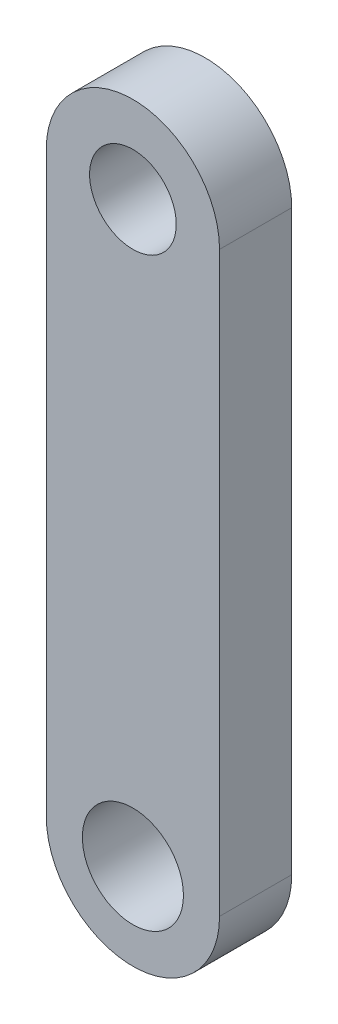
from build123d import *

# Parameters (mm, degrees)
SZKIC1_R                    = 3
SZKIC1_R_2                  = 3.5
DODANIE_WYCI_GNI_CIE1_DEPTH = 5


with BuildPart() as part:
    # Szkic1 → Dodanie-wyciągnięcie1 (new body)
    with BuildSketch(Plane.XY):
        with BuildLine():
            Line((-6, -40), (-6, 0))
            ThreePointArc((-6, 0), (0, 6), (6, 0))
            Line((6, 0), (6, -40))
            ThreePointArc((6, -40), (0, -46), (-6, -40))
        make_face()
        Circle(SZKIC1_R, mode=Mode.SUBTRACT)
        with Locations((0, -40)):
            Circle(SZKIC1_R_2, mode=Mode.SUBTRACT)
    extrude(amount=DODANIE_WYCI_GNI_CIE1_DEPTH)


solid = part.part
